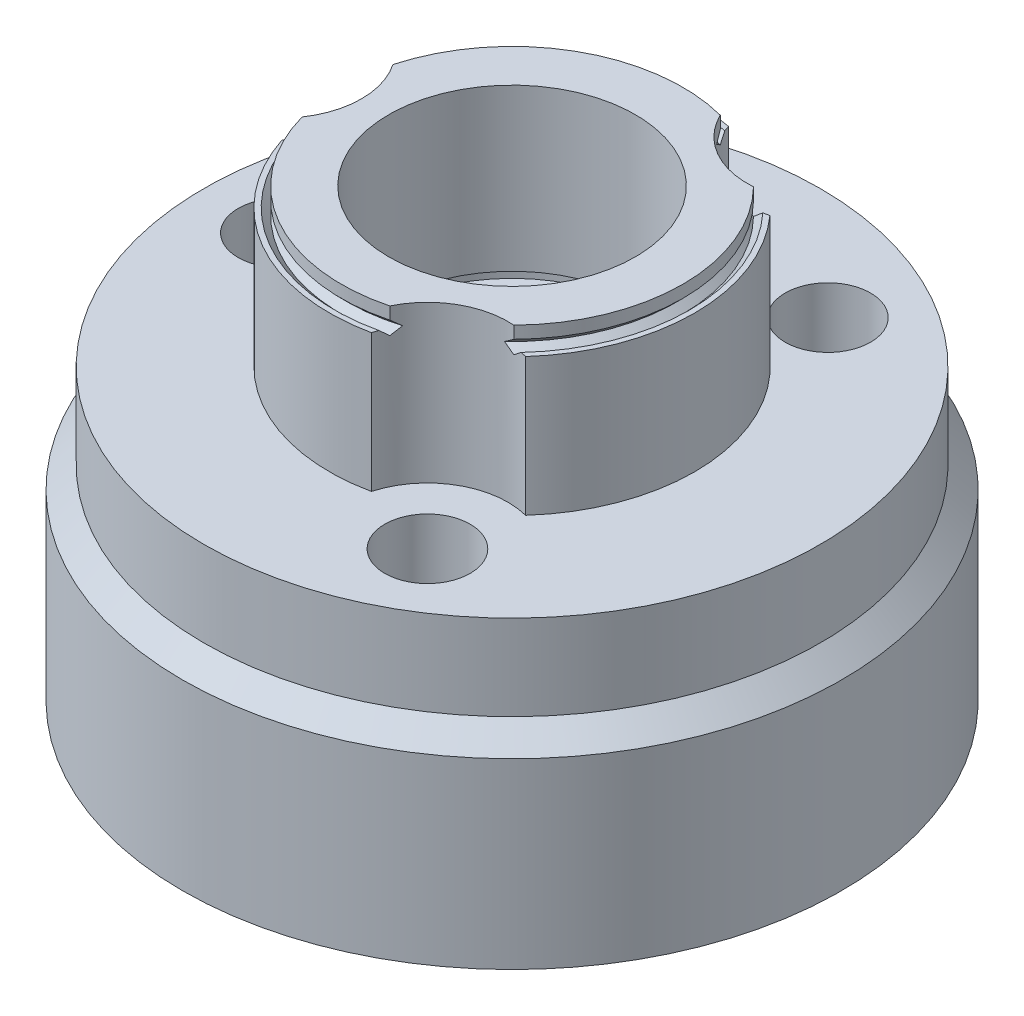
from build123d import *

# Parameters (mm, degrees)
CUT_EXTRUDE_1_REACH = 117.678
SKETCH_2_R          = 17
SKETCH_3_R          = 9
CUT_EXTRUDE_2_DEPTH = 35


with BuildPart() as part:
    # 草图1 → 旋转1 (revolve)
    with BuildSketch(Plane.XY, mode=Mode.PRIVATE) as revolve_1_sk:
        Polygon((63, 0), (63, 26), (26, 26), (26, 37), (27, 37), (27, 39), (22, 39), (22, 58), (27, 58), (27, 60), (26, 60), (26, 94), (36, 94), (36, 91.414213562), (34.585786438, 90), (36, 88.585786438), (37.414213562, 90), (38.5, 90), (38.5, 61), (65, 61), (65, 43), (69.5, 38.5), (69.5, 0), align=None)
    revolve(revolve_1_sk.sketch.rotate(Axis((0, 19.246271831, 0), (0, -1, 0)), 90), axis=Axis((0, 19.246271831, 0), (0, -1, 0)))

    # 切除-拉伸1: up to this face of the body (flat: up to its plane)
    cut_extrude_1_end = Plane(part.part.faces().sort_by_distance((0, 94, -27.018233765))[0])
    # 草图2 → 切除-拉伸1 (cut, up to the picked face)
    with BuildSketch(Plane(origin=(0, 61, 0), x_dir=(1, 0, 0), z_dir=(0, 1, 0)), mode=Mode.PRIVATE) as cut_extrude_1_sk1:
        with Locations((-48.75, 0)):
            Circle(SKETCH_2_R)
    cut_extrude_1_tool1 = split(extrude(cut_extrude_1_sk1.sketch, amount=CUT_EXTRUDE_1_REACH, mode=Mode.PRIVATE), bisect_by=cut_extrude_1_end, keep=Keep.BOTH, mode=Mode.PRIVATE)
    # 草图2 → 切除-拉伸1 (cut, up to the picked face)
    with BuildSketch(Plane(origin=(0, 61, 0), x_dir=(1, 0, 0), z_dir=(0, 1, 0)), mode=Mode.PRIVATE) as cut_extrude_1_sk2:
        with Locations((24.375, 42.218738434)):
            Circle(SKETCH_2_R)
    cut_extrude_1_tool2 = split(extrude(cut_extrude_1_sk2.sketch, amount=CUT_EXTRUDE_1_REACH, mode=Mode.PRIVATE), bisect_by=cut_extrude_1_end, keep=Keep.BOTH, mode=Mode.PRIVATE)
    # 草图2 → 切除-拉伸1 (cut, up to the picked face)
    with BuildSketch(Plane(origin=(0, 61, 0), x_dir=(1, 0, 0), z_dir=(0, 1, 0)), mode=Mode.PRIVATE) as cut_extrude_1_sk3:
        with Locations((24.375, -42.218738434)):
            Circle(SKETCH_2_R)
    cut_extrude_1_tool3 = split(extrude(cut_extrude_1_sk3.sketch, amount=CUT_EXTRUDE_1_REACH, mode=Mode.PRIVATE), bisect_by=cut_extrude_1_end, keep=Keep.BOTH, mode=Mode.PRIVATE)
    add(cut_extrude_1_tool1.solids().sort_by(Axis((-48.75, 61, 0), (0, 1, 0)))[0], mode=Mode.SUBTRACT)
    add(cut_extrude_1_tool2.solids().sort_by(Axis((24.375, 61, -42.218738), (0, 1, 0)))[0], mode=Mode.SUBTRACT)
    add(cut_extrude_1_tool3.solids().sort_by(Axis((24.375, 61, 42.218738), (0, 1, 0)))[0], mode=Mode.SUBTRACT)

    # 草图3 → 切除-拉伸2 (cut)
    with BuildSketch(Plane(origin=(0, 61, 0), x_dir=(1, 0, 0), z_dir=(0, 1, 0))):
        with Locations(Location((24.375, 42.218738434, 0), (0, 0, 270))):
            Circle(SKETCH_3_R)
        with Locations(Location((24.375, -42.218738434, 0), (0, 0, 270))):
            Circle(SKETCH_3_R)
        with Locations(Location((-48.75, 0, 0), (0, 0, 270))):
            Circle(SKETCH_3_R)
    extrude(amount=-CUT_EXTRUDE_2_DEPTH, mode=Mode.SUBTRACT)


solid = part.part
